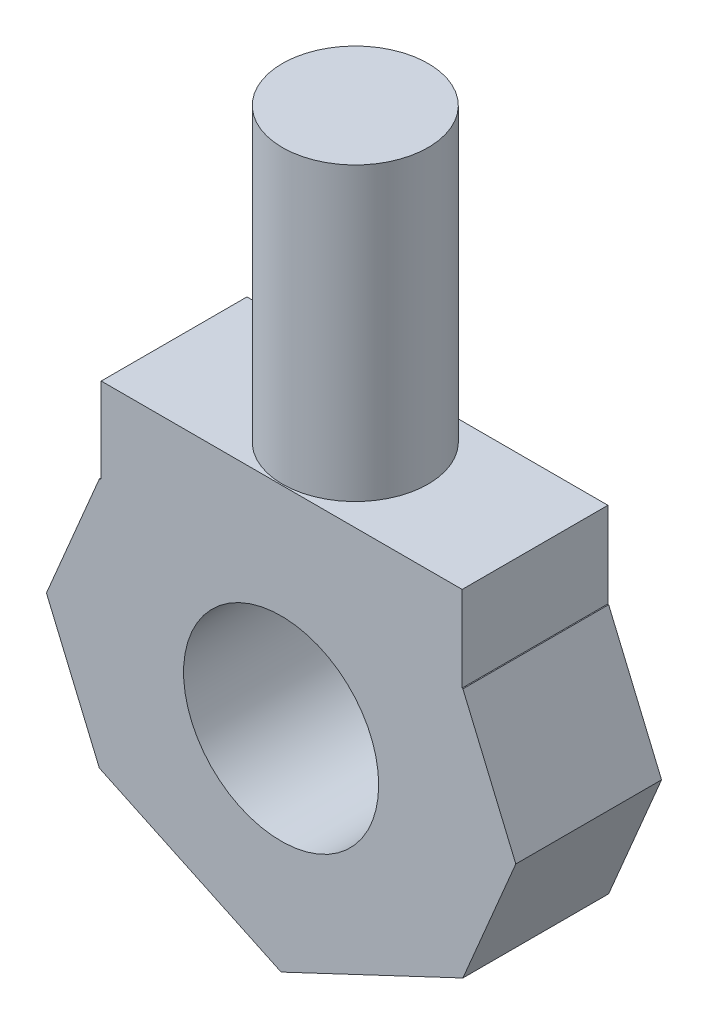
from build123d import *

# Parameters (mm, degrees)
SKETCH1_R           = 6.694456565
BOSS_EXTRUDE1_DEPTH = 10
SKETCH2_W           = 24.765512155
SKETCH2_H           = 10
BOSS_EXTRUDE2_DEPTH = 7
SKETCH4_R           = 5
BOSS_EXTRUDE4_DEPTH = 20


with BuildPart() as part:
    # Sketch1 → Boss-Extrude1 (new body)
    with BuildSketch(Plane.XY):
        Polygon((-12.471629347, -23.064398423), (-16.102258105, -14.474005392), (-12.471629347, -5.883612362), (0, 0), (12.471629347, -5.883612362), (16.102258105, -14.474005392), (12.471629347, -23.064398423), (0, -28.948010785), align=None)
        with Locations((0, -14.474005392)):
            Circle(SKETCH1_R, mode=Mode.SUBTRACT)
    extrude(amount=BOSS_EXTRUDE1_DEPTH)

    # Sketch2 → Boss-Extrude2 (add)
    with BuildSketch(Plane(origin=(0, 0, 0), x_dir=(1, 0, 0), z_dir=(0, 1, 0))):
        with Locations((0.039254209, -5)):
            Rectangle(SKETCH2_W, SKETCH2_H)
    extrude(amount=-BOSS_EXTRUDE2_DEPTH)

    # Sketch4 → Boss-Extrude4 (add)
    with BuildSketch(Plane(origin=(0, 0, 0), x_dir=(1, 0, 0), z_dir=(0, 1, 0))):
        with Locations(Location((0, -4.912660405, 0), (0, 0, 100.724879792))):
            Circle(SKETCH4_R)
    extrude(amount=BOSS_EXTRUDE4_DEPTH)


solid = part.part
